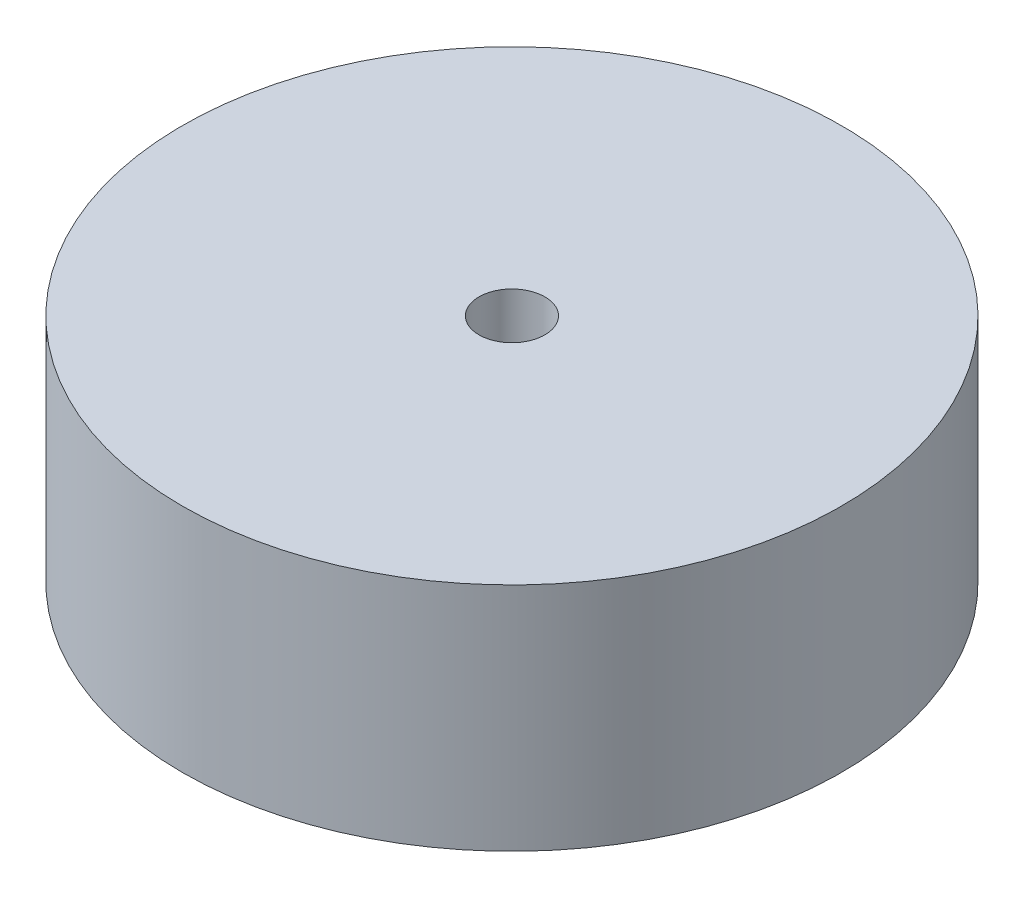
from build123d import *

# Parameters (mm, degrees)
SKETCH1_R           = 10
SKETCH1_R_2         = 1
BOSS_EXTRUDE1_DEPTH = 7


with BuildPart() as part:
    # Sketch1 → Boss-Extrude1 (new body)
    with BuildSketch(Plane(origin=(0, 0, 0), x_dir=(1, 0, 0), z_dir=(0, 1, 0))):
        with Locations(Location((0, 0, 0), (0, 0, 270))):
            Circle(SKETCH1_R)
        with Locations(Location((0, 0, 0), (0, 0, 270))):
            Circle(SKETCH1_R_2, mode=Mode.SUBTRACT)
    extrude(amount=BOSS_EXTRUDE1_DEPTH)


solid = part.part
